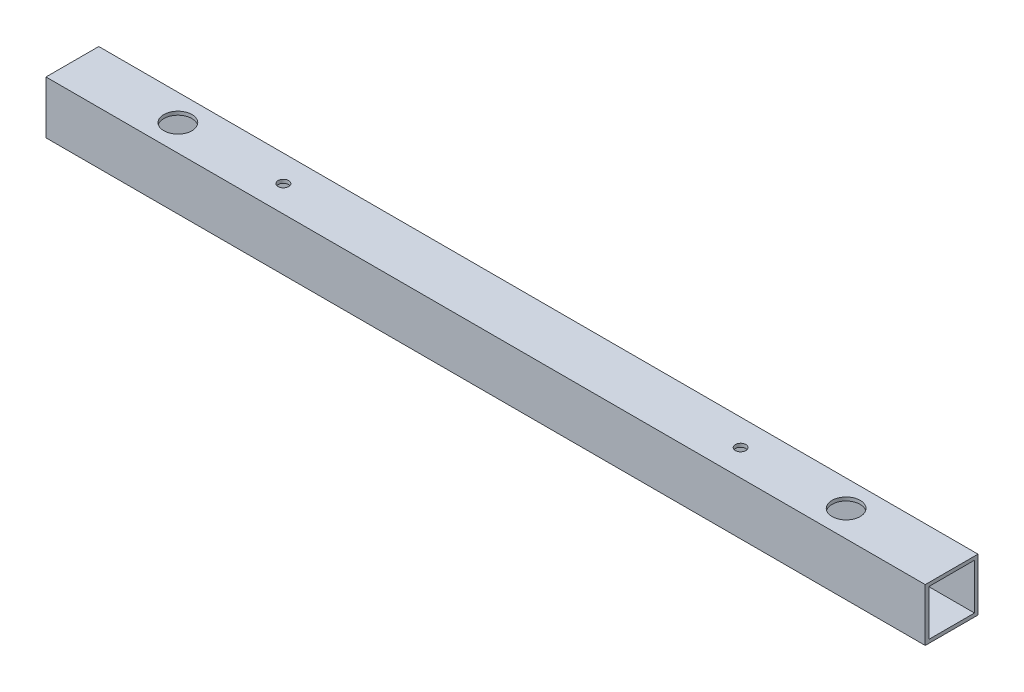
from build123d import *

# Parameters (mm, degrees)
SKETCH_1_W          = 15
SKETCH_1_H          = 15
SKETCH_1_W_2        = 13
SKETCH_1_H_2        = 13
EXTRUDE_1_DEPTH     = 250
SKETCH_2_R          = 1.5
CUT_EXTRUDE_1_DEPTH = 250
SKETCH_3_R          = 4
CUT_EXTRUDE_2_DEPTH = 10
SKETCH_4_R          = 4
CUT_EXTRUDE_3_DEPTH = 10


with BuildPart() as part:
    # 草图1 → 凸台-拉伸1 (new body)
    with BuildSketch(Plane(origin=(0, 0, 0), x_dir=(0, 0, -1), z_dir=(1, 0, 0))):
        Rectangle(SKETCH_1_W, SKETCH_1_H)
        Rectangle(SKETCH_1_W_2, SKETCH_1_H_2, mode=Mode.SUBTRACT)
    extrude(amount=EXTRUDE_1_DEPTH)

    # 草图2 → 切除-拉伸1 (cut)
    with BuildSketch(Plane(origin=(0, 7.5, 0), x_dir=(1, 0, 0), z_dir=(0, 1, 0))):
        with Locations(Location((30, 0, 0), (0, 0, 270))):
            Circle(SKETCH_2_R)
        with Locations(Location((60, 0, 0), (0, 0, 270))):
            Circle(SKETCH_2_R)
        with Locations(Location((190, 0, 0), (0, 0, 90))):
            Circle(SKETCH_2_R)
        with Locations(Location((220, 0, 0), (0, 0, 90))):
            Circle(SKETCH_2_R)
    extrude(amount=-CUT_EXTRUDE_1_DEPTH, mode=Mode.SUBTRACT)

    # 草图3 → 切除-拉伸2 (cut)
    with BuildSketch(Plane(origin=(0, 7.5, 0), x_dir=(1, 0, 0), z_dir=(0, 1, 0))):
        with Locations(Location((30, 0, 0), (0, 0, 270))):
            Circle(SKETCH_3_R)
        with Locations(Location((220, 0, 0), (0, 0, 270))):
            Circle(SKETCH_3_R)
    extrude(amount=-CUT_EXTRUDE_2_DEPTH, mode=Mode.SUBTRACT)

    # 草图4 → 切除-拉伸3 (cut)
    with BuildSketch(Plane.XZ.offset(7.5)):
        with Locations(Location((60, 0, 0), (0, 0, 270))):
            Circle(SKETCH_4_R)
        with Locations(Location((190, 0, 0), (0, 0, 270))):
            Circle(SKETCH_4_R)
    extrude(amount=-CUT_EXTRUDE_3_DEPTH, mode=Mode.SUBTRACT)


solid = part.part
